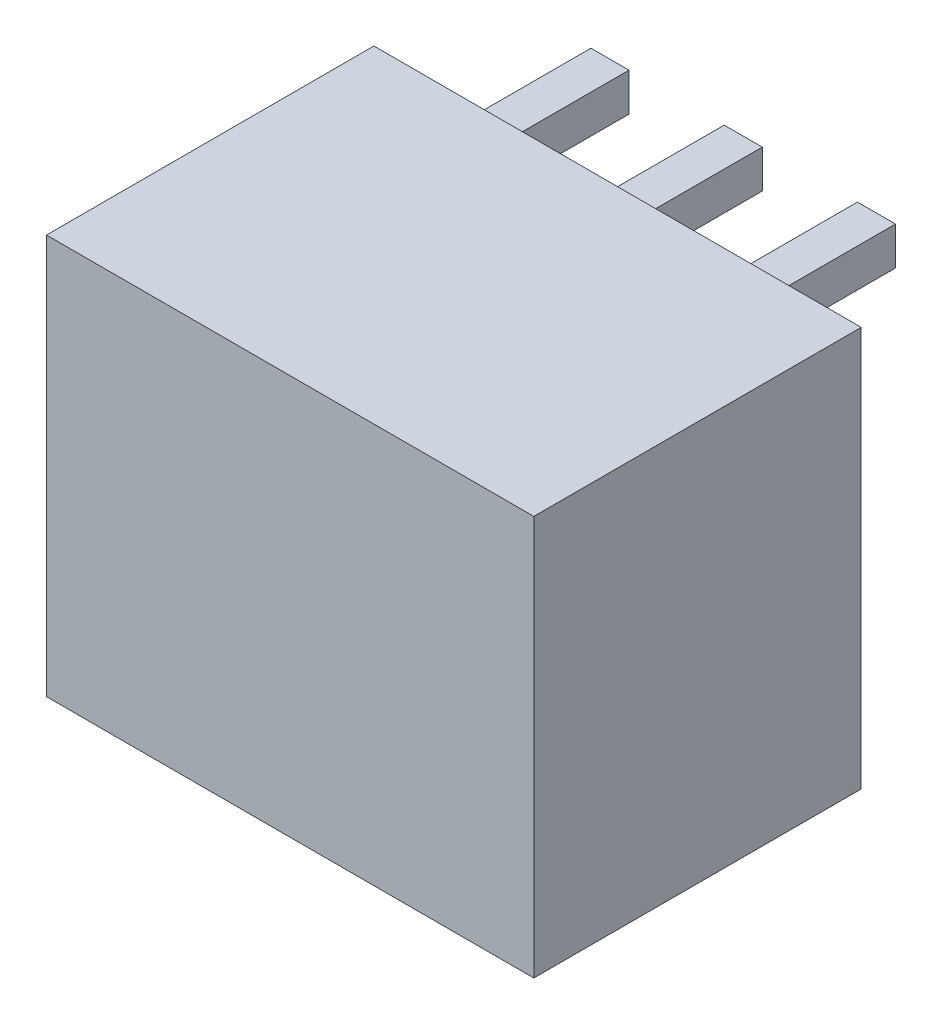
from build123d import *

# Parameters (mm, degrees)
SKETCH_1_W                         = 12.8
SKETCH_1_H                         = 10.5
EXTRUDE_1_DEPTH                    = 8.6
CUT_EXTRUDE_1_DEPTH                = 7
EXTRUDE_START                      = -5
SKETCH_3_W                         = 1
SKETCH_3_H                         = 1
EXTRUDE_2_DEPTH                    = 8.6
CHAMFER_1_SIZE                     = 0.3
PATTERN_LINEAR_1_COUNT             = 3
PATTERN_LINEAR_1_PITCH             = 3.5
CHAMFER_1_OF_PATTERN_LINEAR_1_SIZE = 0.3


with BuildPart() as part:
    # Эскиз1 → Бобышка-Вытянуть1 (new body)
    with BuildSketch(Plane.XY):
        Rectangle(SKETCH_1_W, SKETCH_1_H)
    extrude(amount=EXTRUDE_1_DEPTH)

    # Эскиз2 → Вырез-Вытянуть1 (cut)
    with BuildSketch(Plane.XZ.offset(5.25)):
        Polygon((-5.4, 6.6), (5.4, 6.6), (5.4, 0.2), (3.2, 0.2), (3.2, 1.8), (-1.6, 1.8), (-1.6, 0.2), (-3.8, 0.2), (-3.8, 1.8), (-5.4, 1.8), align=None)
    extrude(amount=-CUT_EXTRUDE_1_DEPTH, mode=Mode.SUBTRACT)

    # Эскиз3 → Бобышка-Вытянуть2 (add)
    with BuildSketch(Plane(origin=(0, 0, 0), x_dir=(-1, 0, 0), z_dir=(0, 0, -1)).offset(EXTRUDE_START)):
        with Locations((3.5, 4.25)):
            Rectangle(SKETCH_3_W, SKETCH_3_H)
    extrude_2 = extrude(amount=EXTRUDE_2_DEPTH)

    # Фаска1
    chamfer_1_edges = [part.edges().sort_by_distance(p)[0] for p in [
        (-3, 4.25, -3.6),
        (-3.5, 3.75, -3.6),
        (-4, 4.25, -3.6),
        (-3.5, 4.75, -3.6),
    ]]
    chamfer(chamfer_1_edges, length=CHAMFER_1_SIZE)

    # Линейный массив1: Бобышка-Вытянуть2 ×3
    with Locations(*[(i * PATTERN_LINEAR_1_PITCH, 0, 0) for i in range(1, PATTERN_LINEAR_1_COUNT)]):
        add(extrude_2)

    # Фаска1 of Линейный массив1
    chamfer_1_of_pattern_linear_1_edges = [part.edges().sort_by_distance(p)[0] for p in [
        (0.5, 4.25, -3.6),
        (0, 3.75, -3.6),
        (-0.5, 4.25, -3.6),
        (0, 4.75, -3.6),
        (4, 4.25, -3.6),
        (3.5, 3.75, -3.6),
        (3, 4.25, -3.6),
        (3.5, 4.75, -3.6),
    ]]
    chamfer(chamfer_1_of_pattern_linear_1_edges, length=CHAMFER_1_OF_PATTERN_LINEAR_1_SIZE)


solid = part.part
